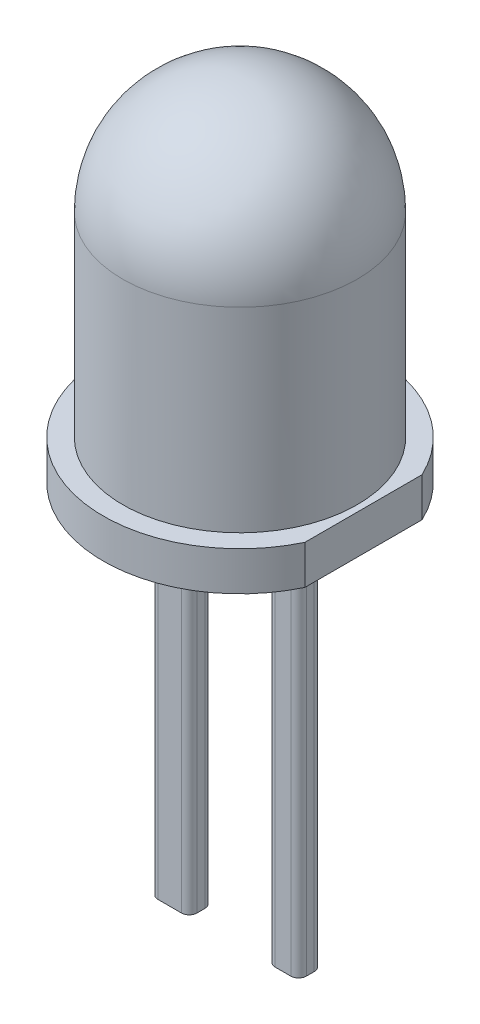
from build123d import *

# Parameters (mm, degrees)
SCHNITT_LINEAR_START            = -1
SCHNITT_LINEAR_AUSTRAGEN1_DEPTH = 1
LINEAR_AUSTRAGEN1_DEPTH         = 5


with BuildPart() as part:
    # Skizze2 → Rotation1 (revolve)
    with BuildSketch(Plane.XY, mode=Mode.PRIVATE) as rotation1_sk:
        with BuildLine():
            Line((0, 0), (-1.75, 0))
            Line((-1.75, 0), (-1.75, 0.5))
            Line((-1.75, 0.5), (-1.5, 0.5))
            Line((-1.5, 0.5), (-1.5, 3))
            ThreePointArc((-1.5, 3), (-1.060660172, 4.060660172), (0, 4.5))
            Line((0, 4.5), (0, 0))
        make_face()
    revolve(rotation1_sk.sketch.rotate(Axis((0, 0, 0), (0, 1, 0)), 270), axis=Axis((0, 0, 0), (0, 1, 0)))

    # Skizze3 → Schnitt-Linear austragen1 (cut)
    with BuildSketch(Plane.XZ.offset(SCHNITT_LINEAR_START)):
        with BuildLine():
            Line((1.58113883, -0.75), (1.58113883, 0.75))
            ThreePointArc((1.58113883, 0.75), (1.75, 0), (1.58113883, -0.75))
        make_face()
    extrude(amount=SCHNITT_LINEAR_AUSTRAGEN1_DEPTH, mode=Mode.SUBTRACT)

    # Skizze4 → Linear austragen1 (add)
    with BuildSketch(Plane.XZ):
        with BuildLine():
            Line((0.6, 0.15), (0.8, 0.15))
            ThreePointArc((0.8, 0.15), (0.870710678, 0.120710678), (0.9, 0.05))
            Line((0.9, 0.05), (0.9, -0.05))
            ThreePointArc((0.9, -0.05), (0.870710678, -0.120710678), (0.8, -0.15))
            Line((0.8, -0.15), (0.6, -0.15))
            ThreePointArc((0.6, -0.15), (0.529289322, -0.120710678), (0.5, -0.05))
            Line((0.5, -0.05), (0.5, 0.05))
            ThreePointArc((0.5, 0.05), (0.529289322, 0.120710678), (0.6, 0.15))
        make_face()
        with BuildLine():
            Line((-0.9, 0.15), (-0.6, 0.15))
            ThreePointArc((-0.6, 0.15), (-0.529289322, 0.120710678), (-0.5, 0.05))
            Line((-0.5, 0.05), (-0.5, -0.05))
            ThreePointArc((-0.5, -0.05), (-0.529289322, -0.120710678), (-0.6, -0.15))
            Line((-0.6, -0.15), (-0.9, -0.15))
            ThreePointArc((-0.9, -0.15), (-0.970710678, -0.120710678), (-1, -0.05))
            Line((-1, -0.05), (-1, 0.05))
            ThreePointArc((-1, 0.05), (-0.970710678, 0.120710678), (-0.9, 0.15))
        make_face()
    extrude(amount=LINEAR_AUSTRAGEN1_DEPTH)


solid = part.part
